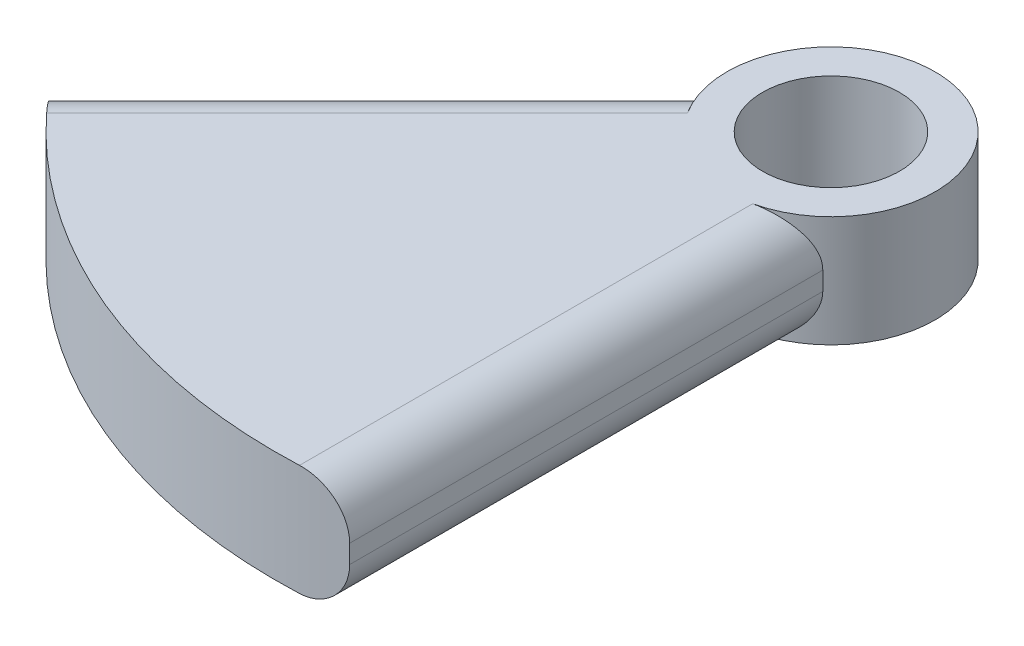
from build123d import *

# Parameters (mm, degrees)
SKETCH1_R           = 14.2875
SKETCH1_R_2         = 9.398
BOSS_EXTRUDE2_DEPTH = 15.24
FILLET1_R           = 6.35


with BuildPart() as part:
    # Sketch1 → Boss-Extrude2 (new body)
    # profile 1 of 2: a face of its own
    with BuildSketch(Plane(origin=(0, 0, 0), x_dir=(1, 0, 0), z_dir=(0, 1, 0))):
        with BuildLine():
            ThreePointArc((9.525, -10.649273743), (-5.46758954, -13.199928821), (-14.265365769, -0.794981587))
            Line((-14.265365769, -0.794981587), (-60.194122004, -46.723737823))
            ThreePointArc((-60.194122004, -46.723737823), (-29.160477546, -70.399620377), (9.525, -75.602343714))
            Line((9.525, -75.602343714), (9.525, -10.649273743))
        make_face()
    # profile 2 of 2: a face of its own
    with BuildSketch(Plane(origin=(0, 0, 0), x_dir=(1, 0, 0), z_dir=(0, 1, 0))):
        Circle(SKETCH1_R)
        with Locations(Location((0, 0, 0), (0, 0, 90))):
            Circle(SKETCH1_R_2, mode=Mode.SUBTRACT)
    extrude(amount=BOSS_EXTRUDE2_DEPTH)

    # Fillet1
    fillet1_edges = [part.edges().sort_by_distance(p)[0] for p in [
        (9.525, 15.24, 43.125808728),
        (-37.229743887, 15.24, 23.759359705),
        (9.525, 0, 43.125808728),
        (-37.229743887, 0, 23.759359705),
    ]]
    fillet(fillet1_edges, radius=FILLET1_R)


solid = part.part
